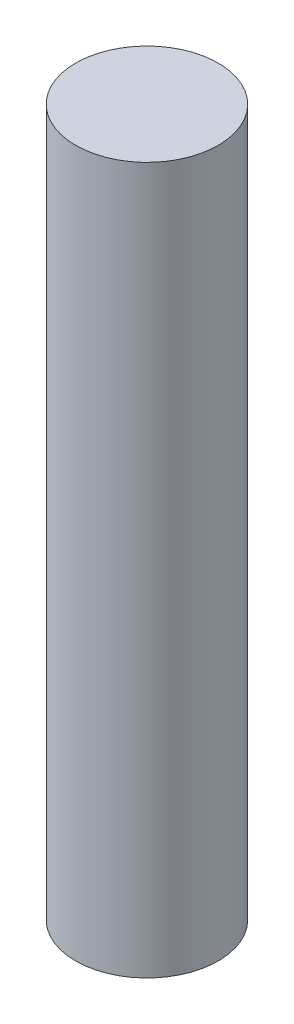
from build123d import *

# Parameters (mm, degrees)
SKETCH_1_R      = 4.5
EXTRUDE_1_DEPTH = 44.6


with BuildPart() as part:
    # 草图1 → 凸台-拉伸1 (new body)
    with BuildSketch(Plane(origin=(0, 0, 0), x_dir=(1, 0, 0), z_dir=(0, 1, 0))):
        with Locations(Location((-47.061192802, 20.666002056, 0), (0, 0, 270))):
            Circle(SKETCH_1_R)
    extrude(amount=EXTRUDE_1_DEPTH)


solid = part.part
